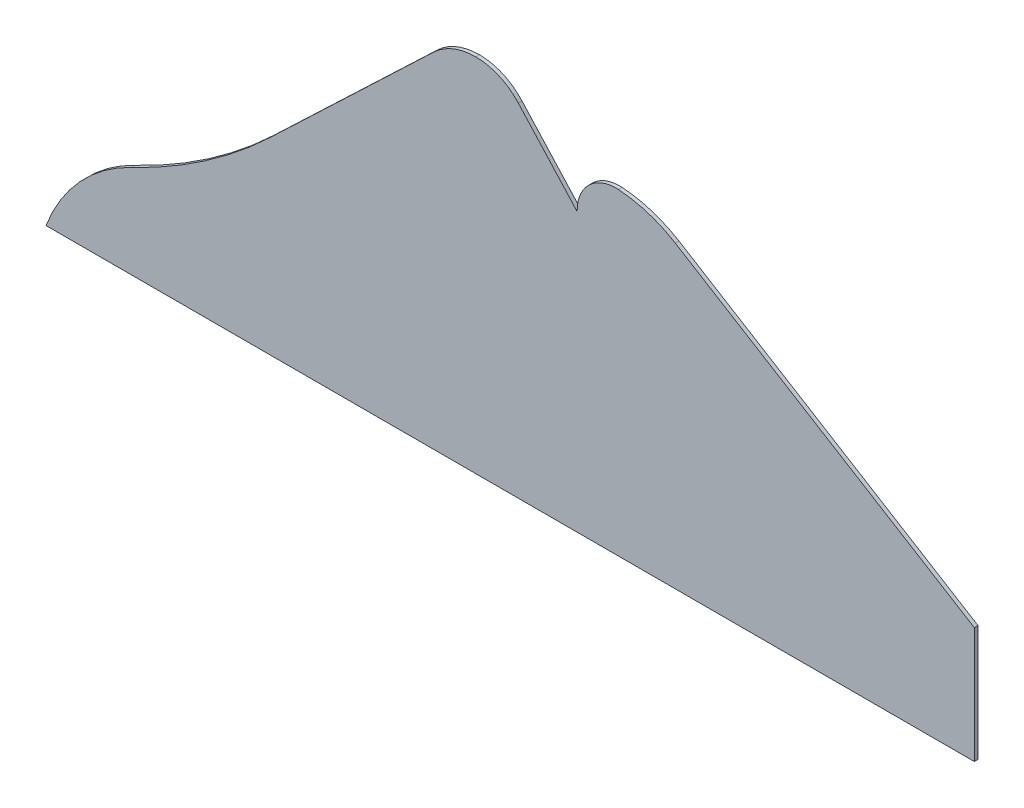
from build123d import *

# Parameters (mm, degrees)
SKETCH1_W           = 800.1
SKETCH1_H           = 311.15
BOSS_EXTRUDE1_DEPTH = 1.5875
CUT_EXTRUDE1_DEPTH  = 859.477963098


with BuildPart() as part:
    # Sketch1 → Boss-Extrude1 (new, symmetric)
    with BuildSketch(Plane.XY):
        with Locations((400.05, 155.575)):
            Rectangle(SKETCH1_W, SKETCH1_H)
    extrude(amount=BOSS_EXTRUDE1_DEPTH, both=True)

    # Sketch2 → Cut-Extrude1 (cut, through all)
    with BuildSketch(Plane.XY.offset(1.5875)):
        with BuildLine():
            ThreePointArc((73.799735787, 80.288462856), (136.885533296, 116.716615986), (193.450443102, 162.621290763))
            Line((193.450443102, 162.621290763), (334.279123198, 296.679860281))
            ThreePointArc((334.279123198, 296.679860281), (350.98014935, 307.39838407), (370.46697579, 311.15))
            Line((370.46697579, 311.15), (0, 311.15))
            Line((0, 311.15), (0, 0))
            ThreePointArc((0, 0), (29.11988212, 47.295456823), (73.799735787, 80.288462856))
        make_face()
        with BuildLine():
            Line((800.1, 311.15), (370.46697579, 311.15))
            ThreePointArc((370.46697579, 311.15), (390.494645186, 306.92285828), (407.105710958, 294.962558849))
            Line((407.105710958, 294.962558849), (457.816588668, 239.285045675))
            ThreePointArc((457.816588668, 239.285045675), (467.985750385, 264.275368722), (493.30296488, 273.60096502))
            ThreePointArc((493.30296488, 273.60096502), (518.828524121, 268.832657986), (542.448186048, 258.0436591))
            Line((542.448186048, 258.0436591), (800.1, 99.941615608))
            Line((800.1, 99.941615608), (800.1, 311.15))
        make_face()
    extrude(amount=-CUT_EXTRUDE1_DEPTH, mode=Mode.SUBTRACT)


solid = part.part
